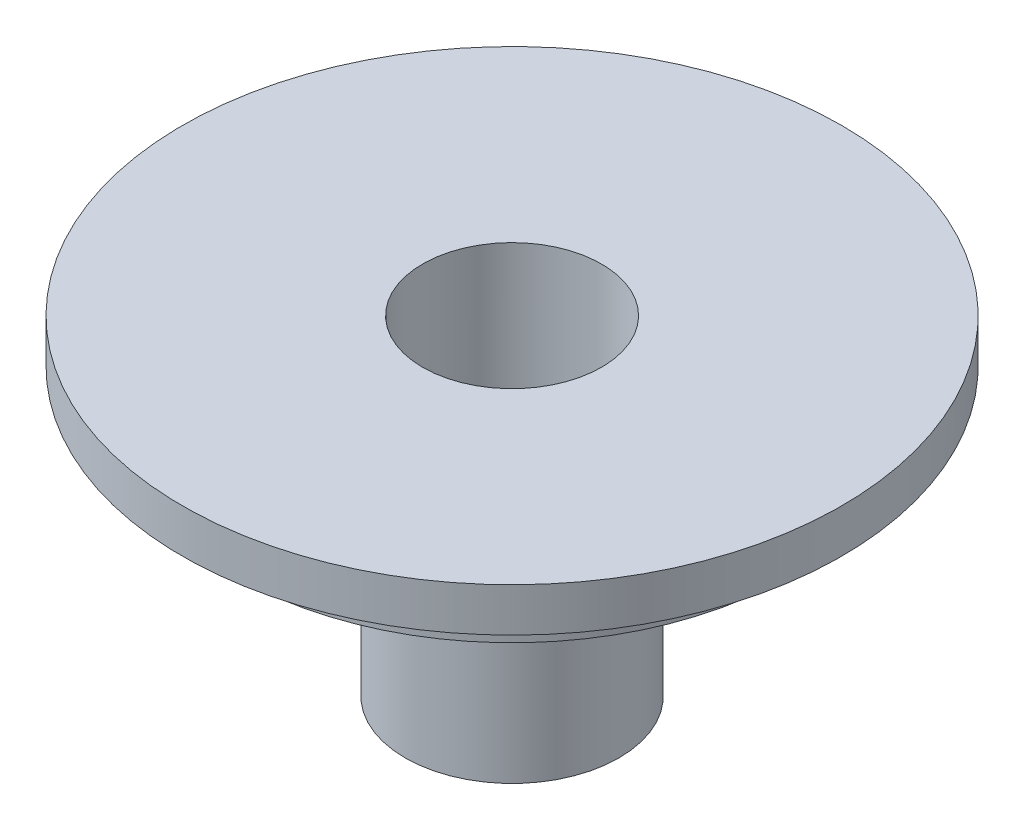
from build123d import *

# Parameters (mm, degrees)
BOSS_EXTRUDE1_DEPTH             = 3
SKETCH4_R                       = 24.5
SKETCH4_R_2                     = 20.5
BOSS_EXTRUDE2_DEPTH             = 10
SKETCH5_R                       = 24.5
SKETCH5_R_2                     = 20.5
BOSS_EXTRUDE3_DEPTH             = 60.5
BOSS_EXTRUDE3_DIRECTION_2_REACH = 110.63
SKETCH6_R                       = 23
CUT_EXTRUDE1_DEPTH              = 5
SKETCH7_R                       = 47.593740697
CUT_EXTRUDE2_DEPTH              = 5


with BuildPart() as part:
    # Sketch1 → Revolve1 (revolve)
    with BuildSketch(Plane.XY, mode=Mode.PRIVATE) as revolve1_sk:
        Polygon((24.5, 0), (24.5, 20), (75.5, 20), (75.5, 10), (64.839745962, 10), (63.5, 5), (63.5, 0), align=None)
    revolve(revolve1_sk.sketch.rotate(Axis((0, 0, 0), (0, 1, 0)), 90), axis=Axis((0, 0, 0), (0, 1, 0)))

    # Sketch3 → Boss-Extrude1 (add)
    with BuildSketch(Plane.XZ.offset(-10)):
        with BuildLine():
            Line((1.5, -73.484692283), (1.5, -63.5))
            Line((1.5, -63.5), (-1.5, -63.5))
            Line((-1.5, -63.5), (-1.5, -73.484692283))
            ThreePointArc((-1.5, -73.484692283), (0, -73.5), (1.5, -73.484692283))
        make_face()
    extrude(amount=BOSS_EXTRUDE1_DEPTH)

    # Sketch4 → Boss-Extrude2 (add)
    with BuildSketch(Plane(origin=(0, 20, 0), x_dir=(1, 0, 0), z_dir=(0, 1, 0))):
        with Locations(Location((0, 0, 0), (0, 0, 90))):
            Circle(SKETCH4_R)
        with Locations(Location((0, 0, 0), (0, 0, 270))):
            Circle(SKETCH4_R_2, mode=Mode.SUBTRACT)
    extrude(amount=-BOSS_EXTRUDE2_DEPTH)

    # Sketch5 → Boss-Extrude3 (add)
    with BuildSketch(Plane.XZ):
        with Locations(Location((0, 0, 0), (0, 0, 270))):
            Circle(SKETCH5_R)
        with Locations(Location((0, 0, 0), (0, 0, 90))):
            Circle(SKETCH5_R_2, mode=Mode.SUBTRACT)
    extrude(amount=BOSS_EXTRUDE3_DEPTH)

    # Sketch5 → Boss-Extrude3 direction 2 (add, up to next)
    with BuildSketch(Plane.XZ, mode=Mode.PRIVATE) as boss_extrude3_direction_2_sk1:
        with Locations(Location((0, 0, 0), (0, 0, 270))):
            Circle(SKETCH5_R)
        with Locations(Location((0, 0, 0), (0, 0, 90))):
            Circle(SKETCH5_R_2, mode=Mode.SUBTRACT)
    boss_extrude3_direction_2_tool1 = extrude(boss_extrude3_direction_2_sk1.sketch, amount=-BOSS_EXTRUDE3_DIRECTION_2_REACH, mode=Mode.PRIVATE) - part.part
    add(boss_extrude3_direction_2_tool1.solids().sort_by_distance((0, 0, 23.807035))[0])

    # Sketch6 → Cut-Extrude1 (cut)
    with BuildSketch(Plane.XZ.offset(60.5)):
        with Locations(Location((0, 0, 0), (0, 0, 270))):
            Circle(SKETCH6_R)
    extrude(amount=-CUT_EXTRUDE1_DEPTH, mode=Mode.SUBTRACT)

    # Sketch7 → Cut-Extrude2 (cut)
    with BuildSketch(Plane.XZ.offset(60.5)):
        Circle(SKETCH7_R)
    extrude(amount=-CUT_EXTRUDE2_DEPTH, mode=Mode.SUBTRACT)


solid = part.part
